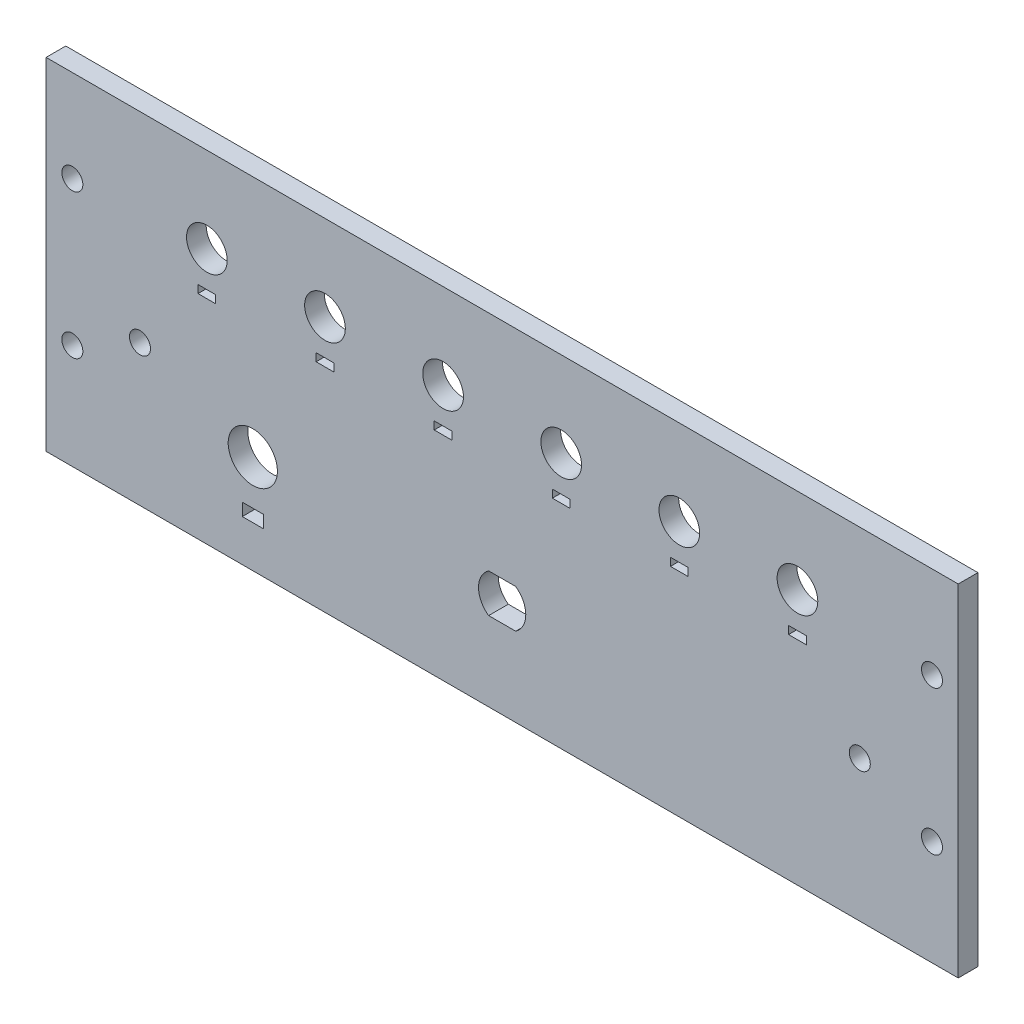
from build123d import *

# Parameters (mm, degrees)
SKETCH1_W           = 139
SKETCH1_H           = 52
SKETCH1_R           = 3.1
SKETCH1_R_2         = 1.6
SKETCH1_R_3         = 3.75
SKETCH1_W_2         = 3.2
SKETCH1_H_2         = 1.9
SKETCH1_W_3         = 2.7
SKETCH1_H_3         = 1.2
BOSS_EXTRUDE1_DEPTH = 3


with BuildPart() as part:
    # Sketch1 → Boss-Extrude1 (new body)
    with BuildSketch(Plane.XY):
        with Locations((69.5, 26)):
            Rectangle(SKETCH1_W, SKETCH1_H)
        with Locations((24.5, 39)):
            Circle(SKETCH1_R, mode=Mode.SUBTRACT)
        with Locations((4, 38)):
            Circle(SKETCH1_R_2, mode=Mode.SUBTRACT)
        with Locations((135, 38)):
            Circle(SKETCH1_R_2, mode=Mode.SUBTRACT)
        with Locations((135, 16)):
            Circle(SKETCH1_R_2, mode=Mode.SUBTRACT)
        with Locations((4, 16)):
            Circle(SKETCH1_R_2, mode=Mode.SUBTRACT)
        with Locations((14.309088021, 21.5)):
            Circle(SKETCH1_R_2, mode=Mode.SUBTRACT)
        with Locations((124, 21.5)):
            Circle(SKETCH1_R_2, mode=Mode.SUBTRACT)
        with Locations((42.5, 39)):
            Circle(SKETCH1_R, mode=Mode.SUBTRACT)
        with Locations((60.5, 39)):
            Circle(SKETCH1_R, mode=Mode.SUBTRACT)
        with Locations((78.5, 39)):
            Circle(SKETCH1_R, mode=Mode.SUBTRACT)
        with Locations((96.5, 39)):
            Circle(SKETCH1_R, mode=Mode.SUBTRACT)
        with Locations((114.5, 39)):
            Circle(SKETCH1_R, mode=Mode.SUBTRACT)
        with Locations((31.5, 15)):
            Circle(SKETCH1_R_3, mode=Mode.SUBTRACT)
        with Locations((31.5, 7.3)):
            Rectangle(SKETCH1_W_2, SKETCH1_H_2, mode=Mode.SUBTRACT)
        with Locations((24.5, 33)):
            Rectangle(SKETCH1_W_3, SKETCH1_H_3, mode=Mode.SUBTRACT)
        with Locations((42.5, 33)):
            Rectangle(SKETCH1_W_3, SKETCH1_H_3, mode=Mode.SUBTRACT)
        with Locations((60.5, 33)):
            Rectangle(SKETCH1_W_3, SKETCH1_H_3, mode=Mode.SUBTRACT)
        with Locations((78.5, 33)):
            Rectangle(SKETCH1_W_3, SKETCH1_H_3, mode=Mode.SUBTRACT)
        with Locations((96.5, 33)):
            Rectangle(SKETCH1_W_3, SKETCH1_H_3, mode=Mode.SUBTRACT)
        with Locations((114.5, 33)):
            Rectangle(SKETCH1_W_3, SKETCH1_H_3, mode=Mode.SUBTRACT)
        with BuildLine():
            Line((67.436628972, 12.05), (71.563371028, 12.05))
            ThreePointArc((71.563371028, 12.05), (73.1, 15), (71.563371028, 17.95))
            Line((71.563371028, 17.95), (67.436628972, 17.95))
            ThreePointArc((67.436628972, 17.95), (65.9, 15), (67.436628972, 12.05))
        make_face(mode=Mode.SUBTRACT)
    extrude(amount=BOSS_EXTRUDE1_DEPTH)


solid = part.part
